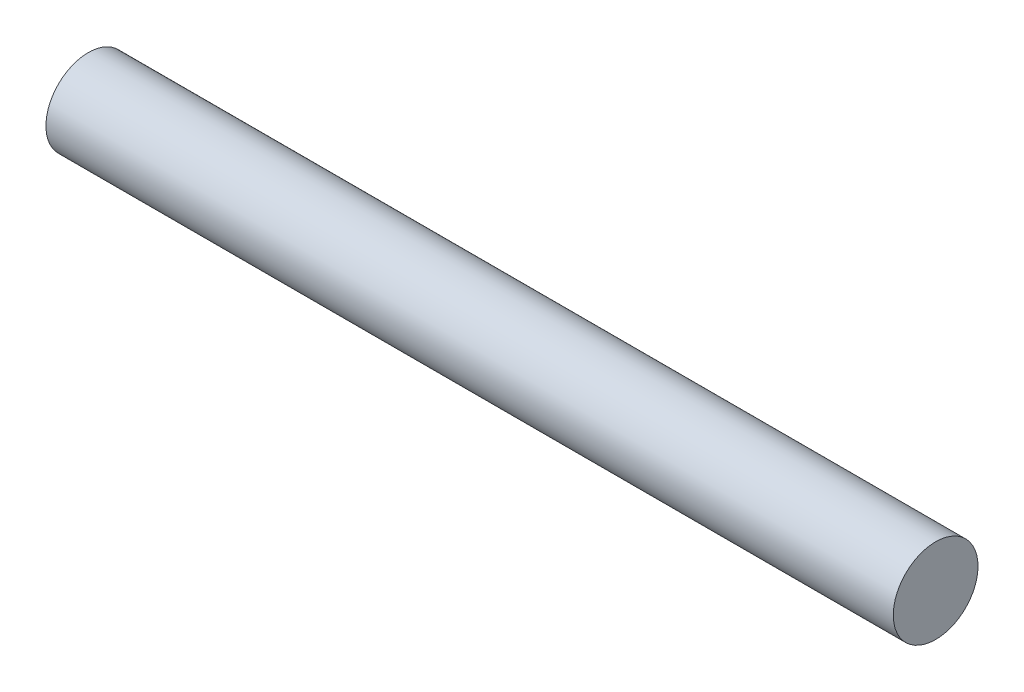
from build123d import *

# Parameters (mm, degrees)
SKETCH1_R           = 12.7
BOSS_EXTRUDE1_DEPTH = 254


with BuildPart() as part:
    # Sketch1 → Boss-Extrude1 (new body)
    with BuildSketch(Plane(origin=(0, 0, 0), x_dir=(0, 0, -1), z_dir=(1, 0, 0))):
        Circle(SKETCH1_R)
    extrude(amount=BOSS_EXTRUDE1_DEPTH)


solid = part.part
